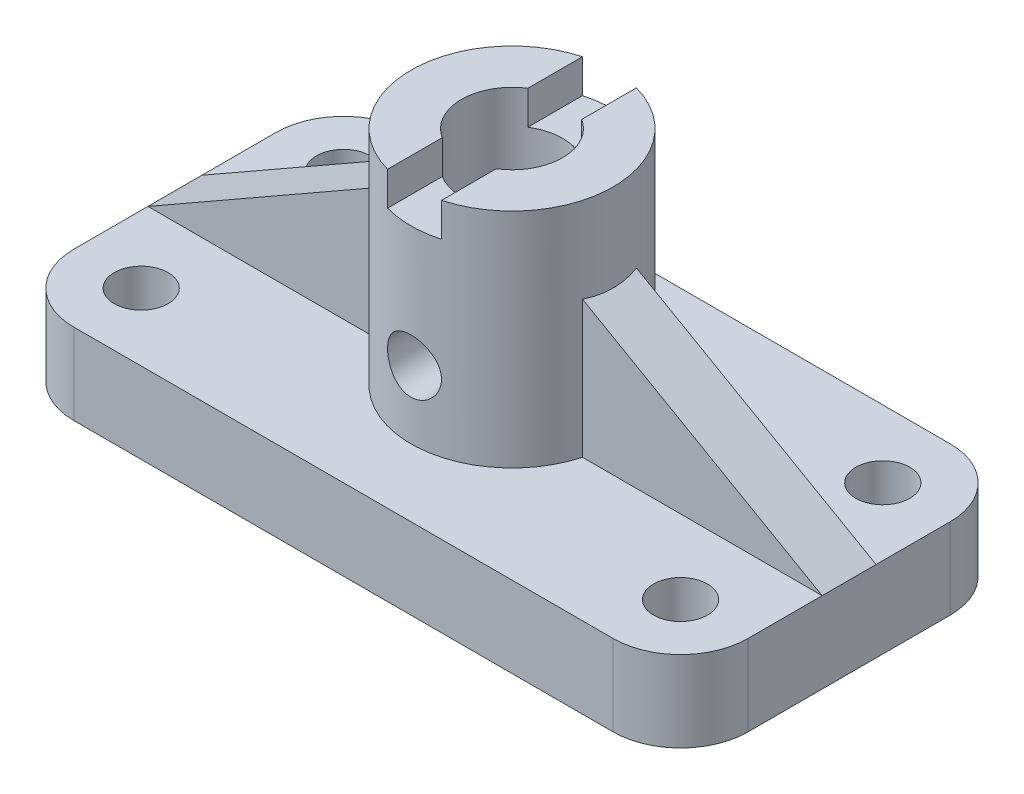
from build123d import *

# Parameters (mm, degrees)
SKETCH_1_R          = 4
EXTRUDE_1_DEPTH     = 12
SKETCH_2_R          = 15
SKETCH_2_R_2        = 7.5
EXTRUDE_2_DEPTH     = 33
SKETCH_3_R          = 4
SKETCH_3_W          = 8
SKETCH_3_H          = 5
CUT_EXTRUDE_1_DEPTH = 84.815273071
RIB_1_REACH         = 73.764
SKETCH_4_WALL_W     = 185.83828981
SKETCH_4_WALL_H     = 8


with BuildPart() as part:
    # 草图1 → 凸台-拉伸1 (new body)
    with BuildSketch(Plane(origin=(0, 0, 0), x_dir=(1, 0, 0), z_dir=(0, 1, 0))):
        with BuildLine():
            Line((-40, -25), (40, -25))
            ThreePointArc((40, -25), (47.071067812, -22.071067812), (50, -15))
            Line((50, -15), (50, 15))
            ThreePointArc((50, 15), (47.071067812, 22.071067812), (40, 25))
            Line((40, 25), (-40, 25))
            ThreePointArc((-40, 25), (-47.071067812, 22.071067812), (-50, 15))
            Line((-50, 15), (-50, -15))
            ThreePointArc((-50, -15), (-47.071067812, -22.071067812), (-40, -25))
        make_face()
        with Locations(Location((-40, 15, 0), (0, 0, 270))):
            Circle(SKETCH_1_R, mode=Mode.SUBTRACT)
        with Locations(Location((-40, -15, 0), (0, 0, 270))):
            Circle(SKETCH_1_R, mode=Mode.SUBTRACT)
        with Locations(Location((40, -15, 0), (0, 0, 270))):
            Circle(SKETCH_1_R, mode=Mode.SUBTRACT)
        with Locations(Location((40, 15, 0), (0, 0, 270))):
            Circle(SKETCH_1_R, mode=Mode.SUBTRACT)
    extrude(amount=EXTRUDE_1_DEPTH)

    # 草图2 → 凸台-拉伸2 (add)
    with BuildSketch(Plane(origin=(0, 12, 0), x_dir=(1, 0, 0), z_dir=(0, 1, 0))):
        with Locations(Location((0, 0, 0), (0, 0, 90))):
            Circle(SKETCH_2_R)
        with Locations(Location((0, 0, 0), (0, 0, 270))):
            Circle(SKETCH_2_R_2, mode=Mode.SUBTRACT)
    extrude(amount=EXTRUDE_2_DEPTH)

    # 草图3 → 切除-拉伸1 (cut, through all)
    with BuildSketch(Plane.XY.offset(25)):
        with Locations((0, 22)):
            Circle(SKETCH_3_R)
        with Locations((0, 42.5)):
            Rectangle(SKETCH_3_W, SKETCH_3_H)
    extrude(amount=-CUT_EXTRUDE_1_DEPTH, mode=Mode.SUBTRACT)

    # 草图4 wall → 筋1 (add, up to next)
    with BuildSketch(Plane(origin=(-32.5, 22, 0), x_dir=(0.868243142124, 0.496138938357, 0), z_dir=(-0.496138938357, 0.868243142124, 0)), mode=Mode.PRIVATE) as rib_1_sk1:
        Rectangle(SKETCH_4_WALL_W, SKETCH_4_WALL_H)
    rib_1_tool1 = extrude(rib_1_sk1.sketch, amount=-RIB_1_REACH, mode=Mode.PRIVATE) - part.part
    rib_1 = rib_1_tool1.solids().sort_by_distance((-32.5, 22, 0))[0]
    add(rib_1)

    # 镜向1: 筋1 across plane
    add(rib_1.mirror(Plane(origin=(0, 0, 0), x_dir=(0, 0, 1), z_dir=(1, 0, 0))))


solid = part.part
